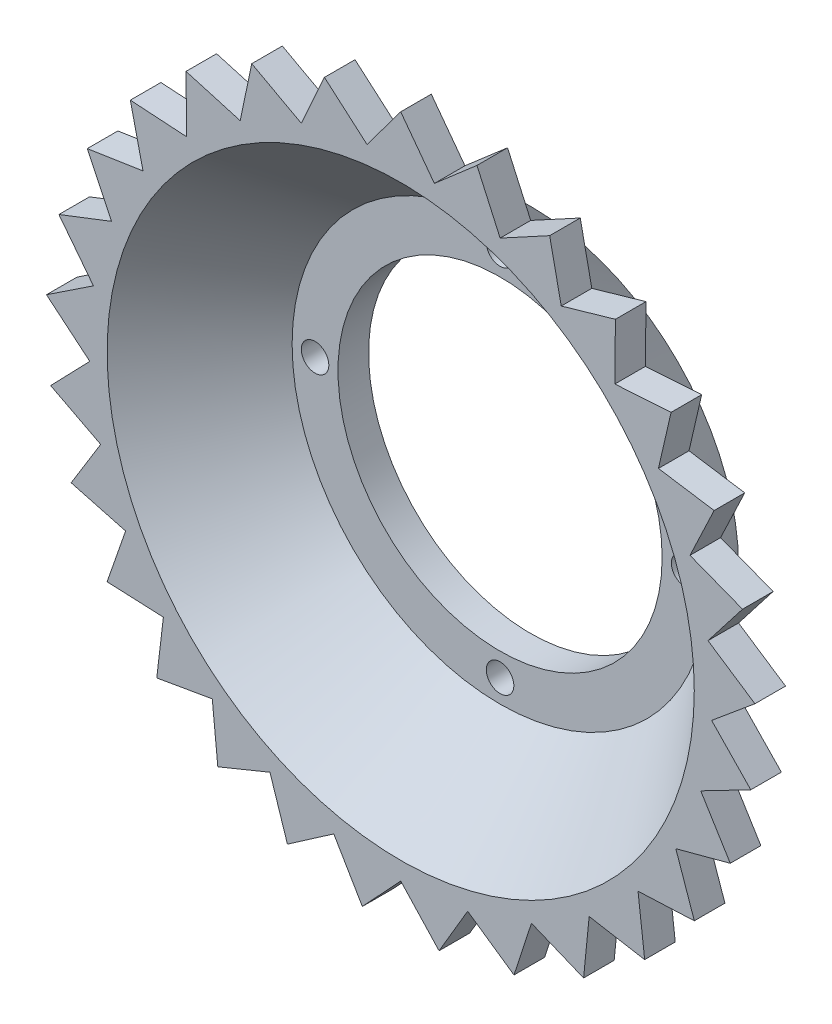
from build123d import *

# Parameters (mm, degrees)
BOSS_EXTRU_1_DEPTH           = 10
R_P_TITION_CIRCULAIRE1_COUNT = 29
ESQUISSE3_R                  = 100
ENL_V_MAT_EXTRU_1_DEPTH      = 165.2332493
D_GAGEMENT_M81_D             = 9


with BuildPart() as part:
    # Esquisse1 → Boss.-Extru.1 (new body)
    with BuildSketch(Plane.XY):
        Polygon((-11.173395042, 101), (0, 0), (11.173395042, 101), (0, 116), align=None)
    extrude(amount=BOSS_EXTRU_1_DEPTH)


with BuildPart() as r_p_tition_circulaire1_1:
    # Répétition circulaire1: pattern copy
    add(part.part.rotate(Axis((0, 0, 0), (0, 0, 1)), 1 * 360 / R_P_TITION_CIRCULAIRE1_COUNT))


with BuildPart() as r_p_tition_circulaire1_2:
    # Répétition circulaire1: pattern copy
    add(part.part.rotate(Axis((0, 0, 0), (0, 0, 1)), 2 * 360 / R_P_TITION_CIRCULAIRE1_COUNT))


with BuildPart() as r_p_tition_circulaire1_3:
    # Répétition circulaire1: pattern copy
    add(part.part.rotate(Axis((0, 0, 0), (0, 0, 1)), 3 * 360 / R_P_TITION_CIRCULAIRE1_COUNT))


with BuildPart() as r_p_tition_circulaire1_4:
    # Répétition circulaire1: pattern copy
    add(part.part.rotate(Axis((0, 0, 0), (0, 0, 1)), 4 * 360 / R_P_TITION_CIRCULAIRE1_COUNT))


with BuildPart() as r_p_tition_circulaire1_5:
    # Répétition circulaire1: pattern copy
    add(part.part.rotate(Axis((0, 0, 0), (0, 0, 1)), 5 * 360 / R_P_TITION_CIRCULAIRE1_COUNT))


with BuildPart() as r_p_tition_circulaire1_6:
    # Répétition circulaire1: pattern copy
    add(part.part.rotate(Axis((0, 0, 0), (0, 0, 1)), 6 * 360 / R_P_TITION_CIRCULAIRE1_COUNT))


with BuildPart() as r_p_tition_circulaire1_7:
    # Répétition circulaire1: pattern copy
    add(part.part.rotate(Axis((0, 0, 0), (0, 0, 1)), 7 * 360 / R_P_TITION_CIRCULAIRE1_COUNT))


with BuildPart() as r_p_tition_circulaire1_8:
    # Répétition circulaire1: pattern copy
    add(part.part.rotate(Axis((0, 0, 0), (0, 0, 1)), 8 * 360 / R_P_TITION_CIRCULAIRE1_COUNT))


with BuildPart() as r_p_tition_circulaire1_9:
    # Répétition circulaire1: pattern copy
    add(part.part.rotate(Axis((0, 0, 0), (0, 0, 1)), 9 * 360 / R_P_TITION_CIRCULAIRE1_COUNT))


with BuildPart() as r_p_tition_circulaire1_10:
    # Répétition circulaire1: pattern copy
    add(part.part.rotate(Axis((0, 0, 0), (0, 0, 1)), 10 * 360 / R_P_TITION_CIRCULAIRE1_COUNT))


with BuildPart() as r_p_tition_circulaire1_11:
    # Répétition circulaire1: pattern copy
    add(part.part.rotate(Axis((0, 0, 0), (0, 0, 1)), 11 * 360 / R_P_TITION_CIRCULAIRE1_COUNT))


with BuildPart() as r_p_tition_circulaire1_12:
    # Répétition circulaire1: pattern copy
    add(part.part.rotate(Axis((0, 0, 0), (0, 0, 1)), 12 * 360 / R_P_TITION_CIRCULAIRE1_COUNT))


with BuildPart() as r_p_tition_circulaire1_13:
    # Répétition circulaire1: pattern copy
    add(part.part.rotate(Axis((0, 0, 0), (0, 0, 1)), 13 * 360 / R_P_TITION_CIRCULAIRE1_COUNT))


with BuildPart() as r_p_tition_circulaire1_14:
    # Répétition circulaire1: pattern copy
    add(part.part.rotate(Axis((0, 0, 0), (0, 0, 1)), 14 * 360 / R_P_TITION_CIRCULAIRE1_COUNT))


with BuildPart() as r_p_tition_circulaire1_15:
    # Répétition circulaire1: pattern copy
    add(part.part.rotate(Axis((0, 0, 0), (0, 0, 1)), 15 * 360 / R_P_TITION_CIRCULAIRE1_COUNT))


with BuildPart() as r_p_tition_circulaire1_16:
    # Répétition circulaire1: pattern copy
    add(part.part.rotate(Axis((0, 0, 0), (0, 0, 1)), 16 * 360 / R_P_TITION_CIRCULAIRE1_COUNT))


with BuildPart() as r_p_tition_circulaire1_17:
    # Répétition circulaire1: pattern copy
    add(part.part.rotate(Axis((0, 0, 0), (0, 0, 1)), 17 * 360 / R_P_TITION_CIRCULAIRE1_COUNT))


with BuildPart() as r_p_tition_circulaire1_18:
    # Répétition circulaire1: pattern copy
    add(part.part.rotate(Axis((0, 0, 0), (0, 0, 1)), 18 * 360 / R_P_TITION_CIRCULAIRE1_COUNT))


with BuildPart() as r_p_tition_circulaire1_19:
    # Répétition circulaire1: pattern copy
    add(part.part.rotate(Axis((0, 0, 0), (0, 0, 1)), 19 * 360 / R_P_TITION_CIRCULAIRE1_COUNT))


with BuildPart() as r_p_tition_circulaire1_20:
    # Répétition circulaire1: pattern copy
    add(part.part.rotate(Axis((0, 0, 0), (0, 0, 1)), 20 * 360 / R_P_TITION_CIRCULAIRE1_COUNT))


with BuildPart() as r_p_tition_circulaire1_21:
    # Répétition circulaire1: pattern copy
    add(part.part.rotate(Axis((0, 0, 0), (0, 0, 1)), 21 * 360 / R_P_TITION_CIRCULAIRE1_COUNT))


with BuildPart() as r_p_tition_circulaire1_22:
    # Répétition circulaire1: pattern copy
    add(part.part.rotate(Axis((0, 0, 0), (0, 0, 1)), 22 * 360 / R_P_TITION_CIRCULAIRE1_COUNT))


with BuildPart() as r_p_tition_circulaire1_23:
    # Répétition circulaire1: pattern copy
    add(part.part.rotate(Axis((0, 0, 0), (0, 0, 1)), 23 * 360 / R_P_TITION_CIRCULAIRE1_COUNT))


with BuildPart() as r_p_tition_circulaire1_24:
    # Répétition circulaire1: pattern copy
    add(part.part.rotate(Axis((0, 0, 0), (0, 0, 1)), 24 * 360 / R_P_TITION_CIRCULAIRE1_COUNT))


with BuildPart() as r_p_tition_circulaire1_25:
    # Répétition circulaire1: pattern copy
    add(part.part.rotate(Axis((0, 0, 0), (0, 0, 1)), 25 * 360 / R_P_TITION_CIRCULAIRE1_COUNT))


with BuildPart() as r_p_tition_circulaire1_26:
    # Répétition circulaire1: pattern copy
    add(part.part.rotate(Axis((0, 0, 0), (0, 0, 1)), 26 * 360 / R_P_TITION_CIRCULAIRE1_COUNT))


with BuildPart() as r_p_tition_circulaire1_27:
    # Répétition circulaire1: pattern copy
    add(part.part.rotate(Axis((0, 0, 0), (0, 0, 1)), 27 * 360 / R_P_TITION_CIRCULAIRE1_COUNT))


with BuildPart() as r_p_tition_circulaire1_28:
    # Répétition circulaire1: pattern copy
    add(part.part.rotate(Axis((0, 0, 0), (0, 0, 1)), 28 * 360 / R_P_TITION_CIRCULAIRE1_COUNT))


with BuildPart() as enl_v_mat_extru_1_tool:
    # Esquisse3 → Enlèv. mat.-Extru.1 (new, through all)
    with BuildSketch(Plane.XY):
        Circle(ESQUISSE3_R)
    extrude(amount=ENL_V_MAT_EXTRU_1_DEPTH)


with BuildPart() as part_1:
    add(part.part)

    # Enlèv. mat.-Extru.1: cut by enl_v_mat_extru_1_tool
    add(enl_v_mat_extru_1_tool.part, mode=Mode.SUBTRACT)



with BuildPart() as r_p_tition_circulaire1_1_1:
    add(r_p_tition_circulaire1_1.part)

    # Enlèv. mat.-Extru.1: cut by enl_v_mat_extru_1_tool
    add(enl_v_mat_extru_1_tool.part, mode=Mode.SUBTRACT)


with BuildPart() as r_p_tition_circulaire1_2_1:
    add(r_p_tition_circulaire1_2.part)

    # Enlèv. mat.-Extru.1: cut by enl_v_mat_extru_1_tool
    add(enl_v_mat_extru_1_tool.part, mode=Mode.SUBTRACT)


with BuildPart() as r_p_tition_circulaire1_3_1:
    add(r_p_tition_circulaire1_3.part)

    # Enlèv. mat.-Extru.1: cut by enl_v_mat_extru_1_tool
    add(enl_v_mat_extru_1_tool.part, mode=Mode.SUBTRACT)


with BuildPart() as r_p_tition_circulaire1_4_1:
    add(r_p_tition_circulaire1_4.part)

    # Enlèv. mat.-Extru.1: cut by enl_v_mat_extru_1_tool
    add(enl_v_mat_extru_1_tool.part, mode=Mode.SUBTRACT)


with BuildPart() as r_p_tition_circulaire1_5_1:
    add(r_p_tition_circulaire1_5.part)

    # Enlèv. mat.-Extru.1: cut by enl_v_mat_extru_1_tool
    add(enl_v_mat_extru_1_tool.part, mode=Mode.SUBTRACT)


with BuildPart() as r_p_tition_circulaire1_6_1:
    add(r_p_tition_circulaire1_6.part)

    # Enlèv. mat.-Extru.1: cut by enl_v_mat_extru_1_tool
    add(enl_v_mat_extru_1_tool.part, mode=Mode.SUBTRACT)


with BuildPart() as r_p_tition_circulaire1_7_1:
    add(r_p_tition_circulaire1_7.part)

    # Enlèv. mat.-Extru.1: cut by enl_v_mat_extru_1_tool
    add(enl_v_mat_extru_1_tool.part, mode=Mode.SUBTRACT)


with BuildPart() as r_p_tition_circulaire1_8_1:
    add(r_p_tition_circulaire1_8.part)

    # Enlèv. mat.-Extru.1: cut by enl_v_mat_extru_1_tool
    add(enl_v_mat_extru_1_tool.part, mode=Mode.SUBTRACT)


with BuildPart() as r_p_tition_circulaire1_9_1:
    add(r_p_tition_circulaire1_9.part)

    # Enlèv. mat.-Extru.1: cut by enl_v_mat_extru_1_tool
    add(enl_v_mat_extru_1_tool.part, mode=Mode.SUBTRACT)


with BuildPart() as r_p_tition_circulaire1_10_1:
    add(r_p_tition_circulaire1_10.part)

    # Enlèv. mat.-Extru.1: cut by enl_v_mat_extru_1_tool
    add(enl_v_mat_extru_1_tool.part, mode=Mode.SUBTRACT)


with BuildPart() as r_p_tition_circulaire1_11_1:
    add(r_p_tition_circulaire1_11.part)

    # Enlèv. mat.-Extru.1: cut by enl_v_mat_extru_1_tool
    add(enl_v_mat_extru_1_tool.part, mode=Mode.SUBTRACT)


with BuildPart() as r_p_tition_circulaire1_12_1:
    add(r_p_tition_circulaire1_12.part)

    # Enlèv. mat.-Extru.1: cut by enl_v_mat_extru_1_tool
    add(enl_v_mat_extru_1_tool.part, mode=Mode.SUBTRACT)


with BuildPart() as r_p_tition_circulaire1_13_1:
    add(r_p_tition_circulaire1_13.part)

    # Enlèv. mat.-Extru.1: cut by enl_v_mat_extru_1_tool
    add(enl_v_mat_extru_1_tool.part, mode=Mode.SUBTRACT)


with BuildPart() as r_p_tition_circulaire1_14_1:
    add(r_p_tition_circulaire1_14.part)

    # Enlèv. mat.-Extru.1: cut by enl_v_mat_extru_1_tool
    add(enl_v_mat_extru_1_tool.part, mode=Mode.SUBTRACT)


with BuildPart() as r_p_tition_circulaire1_15_1:
    add(r_p_tition_circulaire1_15.part)

    # Enlèv. mat.-Extru.1: cut by enl_v_mat_extru_1_tool
    add(enl_v_mat_extru_1_tool.part, mode=Mode.SUBTRACT)


with BuildPart() as r_p_tition_circulaire1_16_1:
    add(r_p_tition_circulaire1_16.part)

    # Enlèv. mat.-Extru.1: cut by enl_v_mat_extru_1_tool
    add(enl_v_mat_extru_1_tool.part, mode=Mode.SUBTRACT)


with BuildPart() as r_p_tition_circulaire1_17_1:
    add(r_p_tition_circulaire1_17.part)

    # Enlèv. mat.-Extru.1: cut by enl_v_mat_extru_1_tool
    add(enl_v_mat_extru_1_tool.part, mode=Mode.SUBTRACT)


with BuildPart() as r_p_tition_circulaire1_18_1:
    add(r_p_tition_circulaire1_18.part)

    # Enlèv. mat.-Extru.1: cut by enl_v_mat_extru_1_tool
    add(enl_v_mat_extru_1_tool.part, mode=Mode.SUBTRACT)


with BuildPart() as r_p_tition_circulaire1_19_1:
    add(r_p_tition_circulaire1_19.part)

    # Enlèv. mat.-Extru.1: cut by enl_v_mat_extru_1_tool
    add(enl_v_mat_extru_1_tool.part, mode=Mode.SUBTRACT)


with BuildPart() as r_p_tition_circulaire1_20_1:
    add(r_p_tition_circulaire1_20.part)

    # Enlèv. mat.-Extru.1: cut by enl_v_mat_extru_1_tool
    add(enl_v_mat_extru_1_tool.part, mode=Mode.SUBTRACT)


with BuildPart() as r_p_tition_circulaire1_21_1:
    add(r_p_tition_circulaire1_21.part)

    # Enlèv. mat.-Extru.1: cut by enl_v_mat_extru_1_tool
    add(enl_v_mat_extru_1_tool.part, mode=Mode.SUBTRACT)


with BuildPart() as r_p_tition_circulaire1_22_1:
    add(r_p_tition_circulaire1_22.part)

    # Enlèv. mat.-Extru.1: cut by enl_v_mat_extru_1_tool
    add(enl_v_mat_extru_1_tool.part, mode=Mode.SUBTRACT)


with BuildPart() as r_p_tition_circulaire1_23_1:
    add(r_p_tition_circulaire1_23.part)

    # Enlèv. mat.-Extru.1: cut by enl_v_mat_extru_1_tool
    add(enl_v_mat_extru_1_tool.part, mode=Mode.SUBTRACT)


with BuildPart() as r_p_tition_circulaire1_24_1:
    add(r_p_tition_circulaire1_24.part)

    # Enlèv. mat.-Extru.1: cut by enl_v_mat_extru_1_tool
    add(enl_v_mat_extru_1_tool.part, mode=Mode.SUBTRACT)


with BuildPart() as r_p_tition_circulaire1_25_1:
    add(r_p_tition_circulaire1_25.part)

    # Enlèv. mat.-Extru.1: cut by enl_v_mat_extru_1_tool
    add(enl_v_mat_extru_1_tool.part, mode=Mode.SUBTRACT)


with BuildPart() as r_p_tition_circulaire1_26_1:
    add(r_p_tition_circulaire1_26.part)

    # Enlèv. mat.-Extru.1: cut by enl_v_mat_extru_1_tool
    add(enl_v_mat_extru_1_tool.part, mode=Mode.SUBTRACT)


with BuildPart() as r_p_tition_circulaire1_27_1:
    add(r_p_tition_circulaire1_27.part)

    # Enlèv. mat.-Extru.1: cut by enl_v_mat_extru_1_tool
    add(enl_v_mat_extru_1_tool.part, mode=Mode.SUBTRACT)


with BuildPart() as r_p_tition_circulaire1_28_1:
    add(r_p_tition_circulaire1_28.part)

    # Enlèv. mat.-Extru.1: cut by enl_v_mat_extru_1_tool
    add(enl_v_mat_extru_1_tool.part, mode=Mode.SUBTRACT)


with BuildPart() as part_2:
    add(part_1.part)

    add(r_p_tition_circulaire1_1_1.part)  # Révolution1 merges Répétition circulaire1_1

    add(r_p_tition_circulaire1_2_1.part)  # Révolution1 merges Répétition circulaire1_2

    add(r_p_tition_circulaire1_3_1.part)  # Révolution1 merges Répétition circulaire1_3

    add(r_p_tition_circulaire1_4_1.part)  # Révolution1 merges Répétition circulaire1_4

    add(r_p_tition_circulaire1_5_1.part)  # Révolution1 merges Répétition circulaire1_5

    add(r_p_tition_circulaire1_6_1.part)  # Révolution1 merges Répétition circulaire1_6

    add(r_p_tition_circulaire1_7_1.part)  # Révolution1 merges Répétition circulaire1_7

    add(r_p_tition_circulaire1_8_1.part)  # Révolution1 merges Répétition circulaire1_8

    add(r_p_tition_circulaire1_9_1.part)  # Révolution1 merges Répétition circulaire1_9

    add(r_p_tition_circulaire1_10_1.part)  # Révolution1 merges Répétition circulaire1_10

    add(r_p_tition_circulaire1_11_1.part)  # Révolution1 merges Répétition circulaire1_11

    add(r_p_tition_circulaire1_12_1.part)  # Révolution1 merges Répétition circulaire1_12

    add(r_p_tition_circulaire1_13_1.part)  # Révolution1 merges Répétition circulaire1_13

    add(r_p_tition_circulaire1_14_1.part)  # Révolution1 merges Répétition circulaire1_14

    add(r_p_tition_circulaire1_15_1.part)  # Révolution1 merges Répétition circulaire1_15

    add(r_p_tition_circulaire1_16_1.part)  # Révolution1 merges Répétition circulaire1_16

    add(r_p_tition_circulaire1_17_1.part)  # Révolution1 merges Répétition circulaire1_17

    add(r_p_tition_circulaire1_18_1.part)  # Révolution1 merges Répétition circulaire1_18

    add(r_p_tition_circulaire1_19_1.part)  # Révolution1 merges Répétition circulaire1_19

    add(r_p_tition_circulaire1_20_1.part)  # Révolution1 merges Répétition circulaire1_20

    add(r_p_tition_circulaire1_21_1.part)  # Révolution1 merges Répétition circulaire1_21

    add(r_p_tition_circulaire1_22_1.part)  # Révolution1 merges Répétition circulaire1_22

    add(r_p_tition_circulaire1_23_1.part)  # Révolution1 merges Répétition circulaire1_23

    add(r_p_tition_circulaire1_24_1.part)  # Révolution1 merges Répétition circulaire1_24

    add(r_p_tition_circulaire1_25_1.part)  # Révolution1 merges Répétition circulaire1_25

    add(r_p_tition_circulaire1_26_1.part)  # Révolution1 merges Répétition circulaire1_26

    add(r_p_tition_circulaire1_27_1.part)  # Révolution1 merges Répétition circulaire1_27

    add(r_p_tition_circulaire1_28_1.part)  # Révolution1 merges Répétition circulaire1_28
    # Esquisse4 → Révolution1 (revolve)
    with BuildSketch(Plane(origin=(0, 0, 0), x_dir=(0, 0, -1), z_dir=(1, 0, 0)), mode=Mode.PRIVATE) as r_volution1_sk:
        Polygon((22.49, 53), (32.49, 53), (32.49, 68), (0, 96), (0, 101), (-10, 101), (-10, 96), (22.49, 68), align=None)
    revolve(r_volution1_sk.sketch.rotate(Axis((0, 0, 61.073575306), (0, 0, -1)), 90), axis=Axis((0, 0, 61.073575306), (0, 0, -1)))

    # Dégagement M81 (through all)
    with Locations(Plane.XY.offset(-22.49)):
        with Locations((0, 60.5), (60.5, 0), (0, -60.5), (-60.5, 0)):
            Hole(D_GAGEMENT_M81_D / 2)


solid = part_2.part
